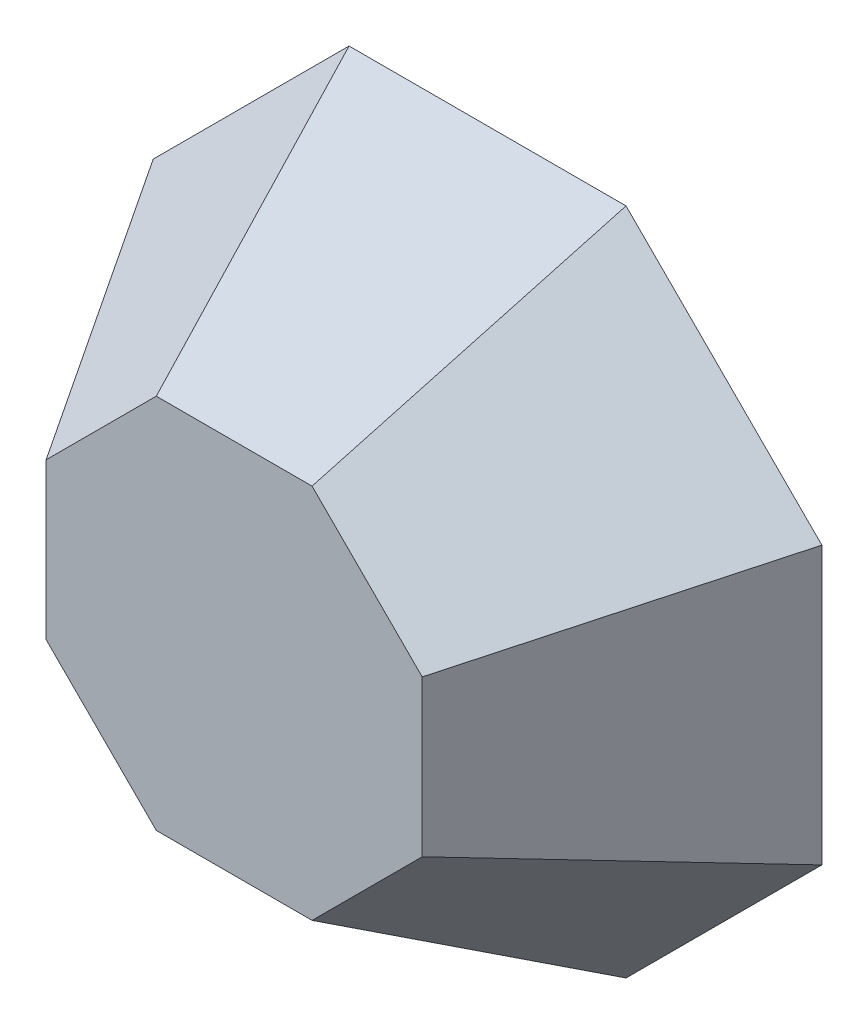
from build123d import *

# Parameters (mm, degrees)
RESSALTO_EXTRUS_O1_DEPTH = 40
RESSALTO_EXTRUS_O1_TAPER = 30


with BuildPart() as part:
    # Esboço1 → Ressalto-extrusão1 (new body)
    with BuildSketch(Plane.XY):
        Polygon((52.78, -21.862191822), (52.78, 21.862191822), (21.862191822, 52.78), (-21.862191822, 52.78), (-52.78, 21.862191822), (-52.78, -21.862191822), (-21.862191822, -52.78), (21.862191822, -52.78), align=None)
    extrude(amount=RESSALTO_EXTRUS_O1_DEPTH, taper=RESSALTO_EXTRUS_O1_TAPER)


solid = part.part
